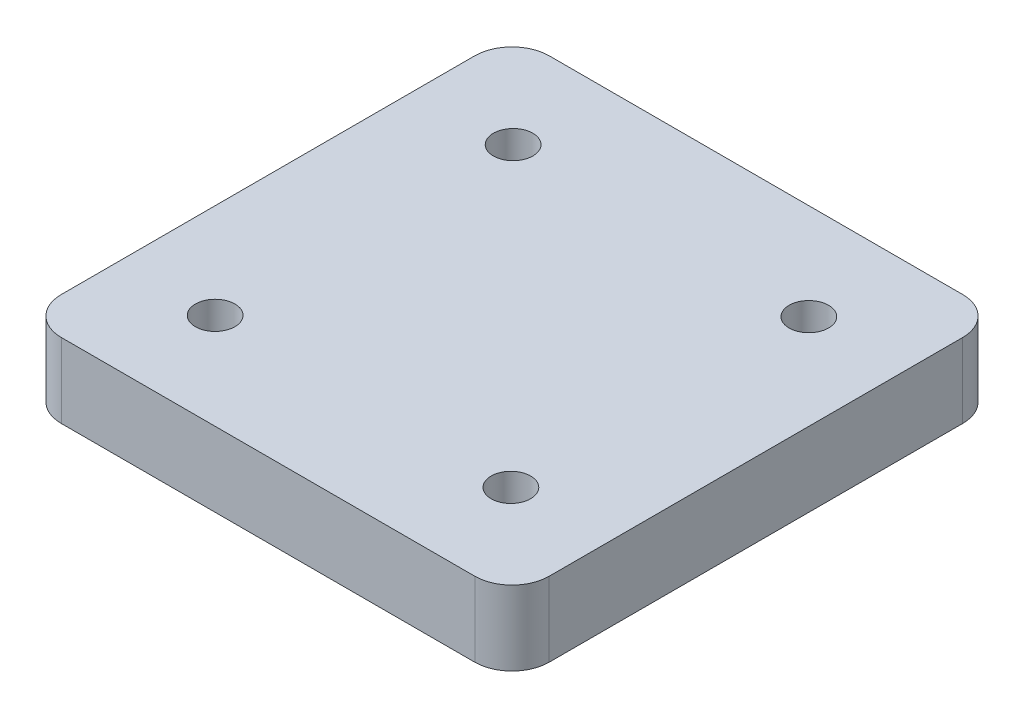
from build123d import *

# Parameters (mm, degrees)
SKETCH2_R           = 2.65
BOSS_EXTRUDE1_DEPTH = 10


with BuildPart() as part:
    # Sketch2 → Boss-Extrude1 (new body)
    with BuildSketch(Plane(origin=(0, 0, 0), x_dir=(1, 0, 0), z_dir=(0, 1, 0))):
        with BuildLine():
            Line((-27.75, -32.75), (27.75, -32.75))
            ThreePointArc((27.75, -32.75), (31.285533906, -31.285533906), (32.75, -27.75))
            Line((32.75, -27.75), (32.75, 27.75))
            ThreePointArc((32.75, 27.75), (31.285533906, 31.285533906), (27.75, 32.75))
            Line((27.75, 32.75), (-27.75, 32.75))
            ThreePointArc((-27.75, 32.75), (-31.285533906, 31.285533906), (-32.75, 27.75))
            Line((-32.75, 27.75), (-32.75, -27.75))
            ThreePointArc((-32.75, -27.75), (-31.285533906, -31.285533906), (-27.75, -32.75))
        make_face()
        with Locations(Location((-19.85, 20, 0), (0, 0, 270))):
            Circle(SKETCH2_R, mode=Mode.SUBTRACT)
        with Locations(Location((20, 19.85, 0), (0, 0, 270))):
            Circle(SKETCH2_R, mode=Mode.SUBTRACT)
        with Locations(Location((19.85, -20, 0), (0, 0, 270))):
            Circle(SKETCH2_R, mode=Mode.SUBTRACT)
        with Locations(Location((-20, -19.85, 0), (0, 0, 270))):
            Circle(SKETCH2_R, mode=Mode.SUBTRACT)
    extrude(amount=BOSS_EXTRUDE1_DEPTH)


solid = part.part
